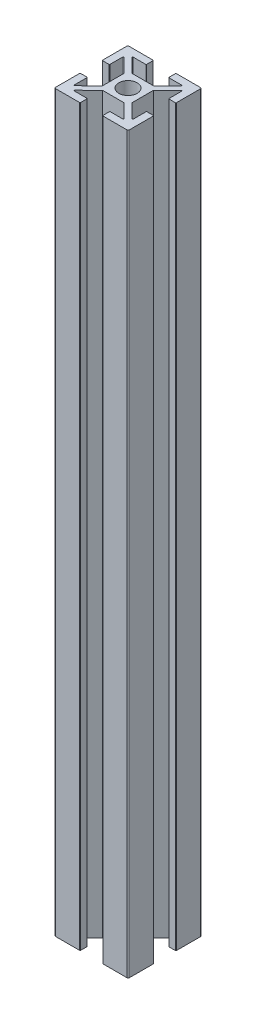
from build123d import *

# Parameters (mm, degrees)
SKETCH1_R           = 2.5
BOSS_EXTRUDE2_DEPTH = 200


with BuildPart() as part:
    # Sketch1 → Boss-Extrude2 (new body)
    with BuildSketch(Plane(origin=(0, 0, 0), x_dir=(1, 0, 0), z_dir=(0, 1, 0))):
        with BuildLine():
            Line((-9.896296296, 3), (-8.196296296, 3))
            ThreePointArc((-8.196296296, 3), (-8.090230279, 3.043933983), (-8.046296296, 3.15))
            Line((-8.046296296, 3.15), (-8.046296296, 6.586184513))
            ThreePointArc((-8.046296296, 6.586184513), (-7.954097251, 6.724600732), (-7.790842301, 6.692859041))
            Line((-7.790842301, 6.692859041), (-4, 2.945390222))
            Line((-4, 2.945390222), (-4, -2.945390222))
            Line((-4, -2.945390222), (-7.790842301, -6.692859041))
            ThreePointArc((-7.790842301, -6.692859041), (-7.954097251, -6.724600732), (-8.046296296, -6.586184513))
            Line((-8.046296296, -6.586184513), (-8.046296296, -3.15))
            ThreePointArc((-8.046296296, -3.15), (-8.090230279, -3.043933983), (-8.196296296, -3))
            Line((-8.196296296, -3), (-9.896296296, -3))
            ThreePointArc((-9.896296296, -3), (-10.002362313, -3.043933983), (-10.046296296, -3.15))
            Line((-10.046296296, -3.15), (-10.046296296, -9.65))
            ThreePointArc((-10.046296296, -9.65), (-9.94378367, -9.897487373), (-9.696296296, -10))
            Line((-9.696296296, -10), (-3.196296296, -10))
            ThreePointArc((-3.196296296, -10), (-3.090230279, -9.956066017), (-3.046296296, -9.85))
            Line((-3.046296296, -9.85), (-3.046296296, -8.15))
            ThreePointArc((-3.046296296, -8.15), (-3.090230279, -8.043933983), (-3.196296296, -8))
            Line((-3.196296296, -8), (-6.614381093, -8))
            ThreePointArc((-6.614381093, -8), (-6.753127587, -7.9070036), (-6.719835089, -7.743325472))
            Line((-6.719835089, -7.743325472), (-2.93318409, -4))
            Line((-2.93318409, -4), (2.93318409, -4))
            Line((2.93318409, -4), (6.719835089, -7.743325472))
            ThreePointArc((6.719835089, -7.743325472), (6.753127587, -7.9070036), (6.614381093, -8))
            Line((6.614381093, -8), (3.196296296, -8))
            ThreePointArc((3.196296296, -8), (3.090230279, -8.043933983), (3.046296296, -8.15))
            Line((3.046296296, -8.15), (3.046296296, -9.85))
            ThreePointArc((3.046296296, -9.85), (3.090230279, -9.956066017), (3.196296296, -10))
            Line((3.196296296, -10), (9.696296296, -10))
            ThreePointArc((9.696296296, -10), (9.94378367, -9.897487373), (10.046296296, -9.65))
            Line((10.046296296, -9.65), (10.046296296, -3.15))
            ThreePointArc((10.046296296, -3.15), (10.002362313, -3.043933983), (9.896296296, -3))
            Line((9.896296296, -3), (8.196296296, -3))
            ThreePointArc((8.196296296, -3), (8.090230279, -3.043933983), (8.046296296, -3.15))
            Line((8.046296296, -3.15), (8.046296296, -6.586184513))
            ThreePointArc((8.046296296, -6.586184513), (7.954097251, -6.724600732), (7.790842301, -6.692859041))
            Line((7.790842301, -6.692859041), (4, -2.945390222))
            Line((4, -2.945390222), (4, 2.945390222))
            Line((4, 2.945390222), (7.790842301, 6.692859041))
            ThreePointArc((7.790842301, 6.692859041), (7.954097251, 6.724600732), (8.046296296, 6.586184513))
            Line((8.046296296, 6.586184513), (8.046296296, 3.15))
            ThreePointArc((8.046296296, 3.15), (8.090230279, 3.043933983), (8.196296296, 3))
            Line((8.196296296, 3), (9.896296296, 3))
            ThreePointArc((9.896296296, 3), (10.002362313, 3.043933983), (10.046296296, 3.15))
            Line((10.046296296, 3.15), (10.046296296, 9.65))
            ThreePointArc((10.046296296, 9.65), (9.94378367, 9.897487373), (9.696296296, 10))
            Line((9.696296296, 10), (3.196296296, 10))
            ThreePointArc((3.196296296, 10), (3.090230279, 9.956066017), (3.046296296, 9.85))
            Line((3.046296296, 9.85), (3.046296296, 8.15))
            ThreePointArc((3.046296296, 8.15), (3.090230279, 8.043933983), (3.196296296, 8))
            Line((3.196296296, 8), (6.614381093, 8))
            ThreePointArc((6.614381093, 8), (6.753127587, 7.9070036), (6.719835089, 7.743325472))
            Line((6.719835089, 7.743325472), (2.93318409, 4))
            Line((2.93318409, 4), (-2.93318409, 4))
            Line((-2.93318409, 4), (-6.719835089, 7.743325472))
            ThreePointArc((-6.719835089, 7.743325472), (-6.753127587, 7.9070036), (-6.614381093, 8))
            Line((-6.614381093, 8), (-3.196296296, 8))
            ThreePointArc((-3.196296296, 8), (-3.090230279, 8.043933983), (-3.046296296, 8.15))
            Line((-3.046296296, 8.15), (-3.046296296, 9.85))
            ThreePointArc((-3.046296296, 9.85), (-3.090230279, 9.956066017), (-3.196296296, 10))
            Line((-3.196296296, 10), (-9.696296296, 10))
            ThreePointArc((-9.696296296, 10), (-9.94378367, 9.897487373), (-10.046296296, 9.65))
            Line((-10.046296296, 9.65), (-10.046296296, 3.15))
            ThreePointArc((-10.046296296, 3.15), (-10.002362313, 3.043933983), (-9.896296296, 3))
        make_face()
        with Locations(Location((0, 0, 0), (0, 0, 270))):
            Circle(SKETCH1_R, mode=Mode.SUBTRACT)
    extrude(amount=BOSS_EXTRUDE2_DEPTH)


solid = part.part
